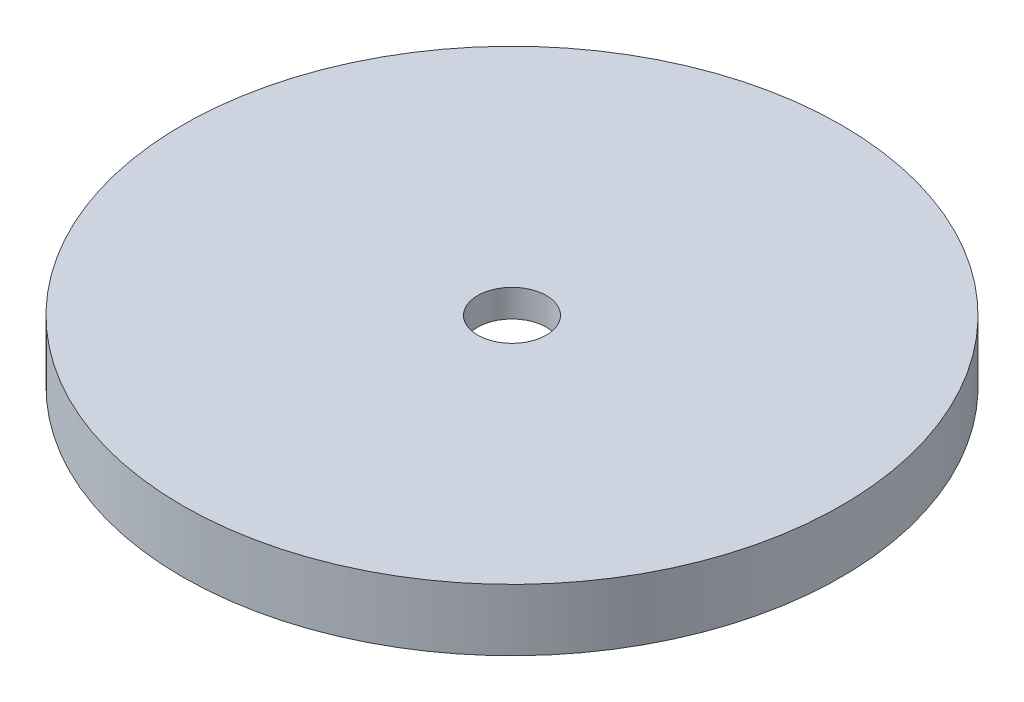
from build123d import *

# Parameters (mm, degrees)
SKETCH1_R           = 24
SKETCH1_R_2         = 19
BOSS_EXTRUDE1_DEPTH = 2.5
SKETCH2_R           = 24
BOSS_EXTRUDE2_DEPTH = 2
SKETCH3_R           = 2.5
CUT_EXTRUDE1_DEPTH  = 35.238136632


with BuildPart() as part:
    # Sketch1 → Boss-Extrude1 (new body)
    with BuildSketch(Plane(origin=(0, 0, 0), x_dir=(1, 0, 0), z_dir=(0, 1, 0))):
        with Locations(Location((0, 0, 0), (0, 0, 270))):
            Circle(SKETCH1_R)
        with Locations(Location((0, 0, 0), (0, 0, 270))):
            Circle(SKETCH1_R_2, mode=Mode.SUBTRACT)
    extrude(amount=BOSS_EXTRUDE1_DEPTH)

    # Sketch2 → Boss-Extrude2 (add)
    with BuildSketch(Plane(origin=(0, 2.5, 0), x_dir=(1, 0, 0), z_dir=(0, 1, 0))):
        with Locations(Location((0, 0, 0), (0, 0, 270))):
            Circle(SKETCH2_R)
    extrude(amount=BOSS_EXTRUDE2_DEPTH)

    # Sketch3 → Cut-Extrude1 (cut, through all)
    with BuildSketch(Plane.XZ):
        with Locations(Location((0, 0, 0), (0, 0, 270))):
            Circle(SKETCH3_R)
    extrude(amount=-CUT_EXTRUDE1_DEPTH, mode=Mode.SUBTRACT)


solid = part.part
